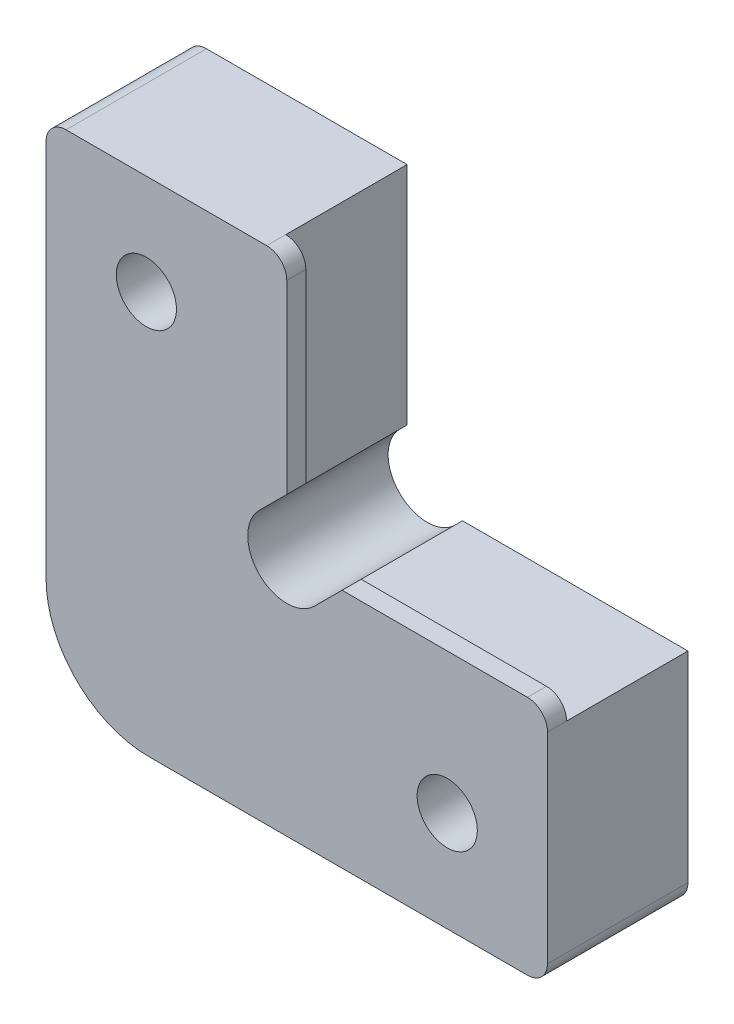
from build123d import *

# Parameters (mm, degrees)
SKETCH1_R           = 1.5
BOSS_EXTRUDE1_DEPTH = 7
BOSS_EXTRUDE2_DEPTH = 0.95


with BuildPart() as part:
    # Sketch1 → Boss-Extrude1 (new body)
    with BuildSketch(Plane.XY):
        with BuildLine():
            Line((-11, 13.003727625), (-11, -5.867758287))
            ThreePointArc((-11, -5.867758287), (-9.496801205, -9.496801205), (-5.867758287, -11))
            Line((-5.867758287, -11), (13.003727625, -11))
            ThreePointArc((13.003727625, -11), (13.708198577, -10.708198577), (14, -10.003727625))
            Line((14, -10.003727625), (14, 0))
            Line((14, 0), (2.757716447, 0))
            Line((2.757716447, 0), (2.382592719, -0.375123728))
            ThreePointArc((2.382592719, -0.375123728), (-0.375123728, -0.375123728), (-0.375123728, 2.382592719))
            Line((-0.375123728, 2.382592719), (0, 2.757716447))
            Line((0, 2.757716447), (0, 14))
            Line((0, 14), (-10.003727625, 14))
            ThreePointArc((-10.003727625, 14), (-10.708198577, 13.708198577), (-11, 13.003727625))
        make_face()
        with Locations((9, -6)):
            Circle(SKETCH1_R, mode=Mode.SUBTRACT)
        with Locations((-6, 9)):
            Circle(SKETCH1_R, mode=Mode.SUBTRACT)
    extrude(amount=BOSS_EXTRUDE1_DEPTH)

    # Sketch2 → Boss-Extrude2 (add)
    with BuildSketch(Plane.XY.offset(7)):
        with BuildLine():
            Line((2.757716447, 0), (3.757716447, 1))
            Line((3.757716447, 1), (13, 1))
            ThreePointArc((13, 1), (13.707106781, 0.707106781), (14, 0))
            Line((14, 0), (2.757716447, 0))
        make_face()
        with BuildLine():
            Line((0, 2.757716447), (1, 3.757716447))
            Line((1, 3.757716447), (1, 13))
            ThreePointArc((1, 13), (0.707106781, 13.707106781), (0, 14))
            Line((0, 14), (0, 2.757716447))
        make_face()
    extrude(amount=-BOSS_EXTRUDE2_DEPTH)


solid = part.part
